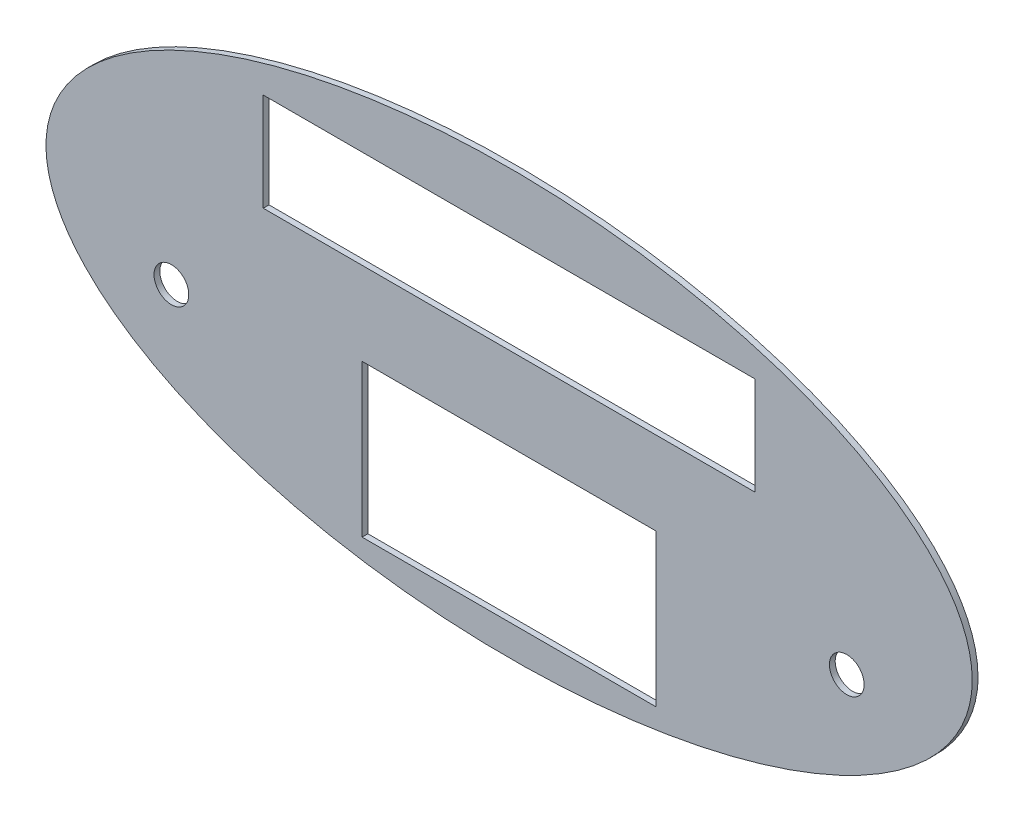
from build123d import *

# Parameters (mm, degrees)
SKETCH1_RX          = 240
SKETCH1_RY          = 110
BOSS_EXTRUDE1_DEPTH = 3
SKETCH10_W          = 254.8
SKETCH10_H          = 50.8
CUT_EXTRUDE5_DEPTH  = 265.024620064
SKETCH13_W          = 152.4
SKETCH13_H          = 78.9
CUT_EXTRUDE7_DEPTH  = 265.024620064
SKETCH12_R          = 9
CUT_EXTRUDE8_DEPTH  = 265.024620064


with BuildPart() as part:
    # Sketch1 → Boss-Extrude1 (new body)
    with BuildSketch(Plane.XY):
        with Locations((0, 0)):
            Ellipse(SKETCH1_RX, SKETCH1_RY)
    extrude(amount=-BOSS_EXTRUDE1_DEPTH)

    # Sketch10 → Cut-Extrude5 (cut, through all)
    with BuildSketch(Plane.XY):
        with Locations((0, 53.5)):
            Rectangle(SKETCH10_W, SKETCH10_H)
    extrude(amount=-CUT_EXTRUDE5_DEPTH, mode=Mode.SUBTRACT)

    # Sketch13 → Cut-Extrude7 (cut, through all)
    with BuildSketch(Plane.XY):
        with Locations((0, -54.45)):
            Rectangle(SKETCH13_W, SKETCH13_H)
    extrude(amount=-CUT_EXTRUDE7_DEPTH, mode=Mode.SUBTRACT)

    # Sketch12 → Cut-Extrude8 (cut, through all)
    with BuildSketch(Plane.XY):
        with Locations((175, -30)):
            Circle(SKETCH12_R)
        with Locations(Location((-175, -30, 0), (0, 0, 180))):
            Circle(SKETCH12_R)
    extrude(amount=-CUT_EXTRUDE8_DEPTH, mode=Mode.SUBTRACT)


solid = part.part
